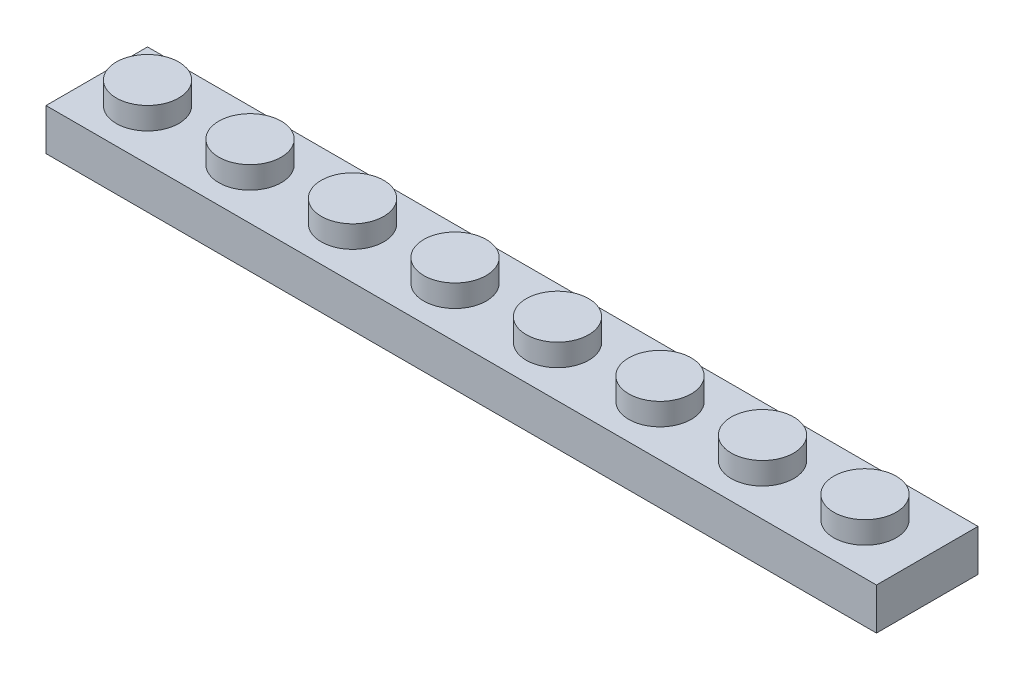
from build123d import *

# Parameters (mm, degrees)
SKETCH_1_W          = 63.8
SKETCH_1_H          = 7.8
EXTRUDE_1_DEPTH     = 3.2
SKETCH_2_R          = 2.4
EXTRUDE_2_DEPTH     = 1.7
SKETCH_3_R          = 2.5
CUT_EXTRUDE_1_DEPTH = 1.8


with BuildPart() as part:
    # Эскиз1 → Бобышка-Вытянуть1 (new body)
    with BuildSketch(Plane(origin=(0, 0, 0), x_dir=(1, 0, 0), z_dir=(0, 1, 0))):
        Rectangle(SKETCH_1_W, SKETCH_1_H)
    extrude(amount=EXTRUDE_1_DEPTH)

    # Эскиз2 → Бобышка-Вытянуть2 (add)
    with BuildSketch(Plane(origin=(0, 3.2, 0), x_dir=(1, 0, 0), z_dir=(0, 1, 0))):
        with Locations(Location((-28, 0, 0), (0, 0, 270))):
            Circle(SKETCH_2_R)
        with Locations(Location((-20.126, 0, 0), (0, 0, 270))):
            Circle(SKETCH_2_R)
        with Locations(Location((-12.252, 0, 0), (0, 0, 270))):
            Circle(SKETCH_2_R)
        with Locations(Location((-4.378, 0, 0), (0, 0, 270))):
            Circle(SKETCH_2_R)
        with Locations(Location((3.496, 0, 0), (0, 0, 270))):
            Circle(SKETCH_2_R)
        with Locations(Location((11.37, 0, 0), (0, 0, 270))):
            Circle(SKETCH_2_R)
        with Locations(Location((19.244, 0, 0), (0, 0, 270))):
            Circle(SKETCH_2_R)
        with Locations(Location((27.118, 0, 0), (0, 0, 270))):
            Circle(SKETCH_2_R)
    extrude(amount=EXTRUDE_2_DEPTH)

    # Эскиз3 → Вырез-Вытянуть1 (cut)
    with BuildSketch(Plane.XZ):
        with Locations(Location((-28, 0, 0), (0, 0, 270))):
            Circle(SKETCH_3_R)
        with Locations(Location((-20.126, 0, 0), (0, 0, 270))):
            Circle(SKETCH_3_R)
        with Locations(Location((-12.252, 0, 0), (0, 0, 270))):
            Circle(SKETCH_3_R)
        with Locations(Location((-4.378, 0, 0), (0, 0, 270))):
            Circle(SKETCH_3_R)
        with Locations(Location((3.496, 0, 0), (0, 0, 270))):
            Circle(SKETCH_3_R)
        with Locations(Location((11.37, 0, 0), (0, 0, 270))):
            Circle(SKETCH_3_R)
        with Locations(Location((19.244, 0, 0), (0, 0, 270))):
            Circle(SKETCH_3_R)
        with Locations(Location((27.118, 0, 0), (0, 0, 270))):
            Circle(SKETCH_3_R)
    extrude(amount=-CUT_EXTRUDE_1_DEPTH, mode=Mode.SUBTRACT)


solid = part.part
